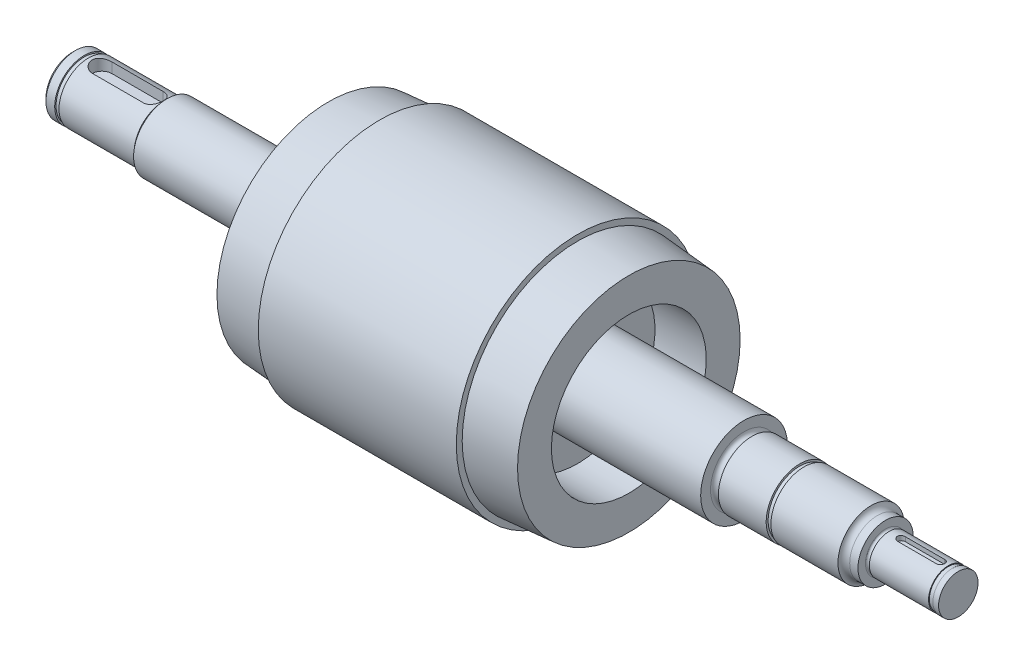
from build123d import *

# Parameters (mm, degrees)
ENL_V_MAT_EXTRU_1_DEPTH = 3
ENL_V_MAT_EXTRU_2_DEPTH = 1.2


with BuildPart() as part:
    # Esquisse1 → Révolution1 (revolve)
    with BuildSketch(Plane.XY, mode=Mode.PRIVATE) as r_volution1_sk:
        with BuildLine():
            Line((3, 7.5), (0.8, 7.5))
            Line((0.8, 7.5), (0, 6.7))
            Line((0, 6.7), (0, 0))
            Line((0, 0), (224.59, 0))
            Line((224.59, 0), (224.59, 5))
            Line((224.59, 5), (223.15, 5))
            Line((223.15, 5), (223.15, 4.8))
            Line((223.15, 4.8), (222.05, 4.8))
            Line((222.05, 4.8), (222.05, 5))
            Line((222.05, 5), (207.04, 5))
            ThreePointArc((207.04, 5), (206.552565835, 4.646846795), (206.15, 5.094339811))
            Line((206.15, 5.094339811), (206.15, 7))
            Line((206.15, 7), (204.056158882, 7))
            ThreePointArc((204.056158882, 7), (203.001644776, 7.396671283), (202.47, 8.39))
            Line((202.47, 8.39), (185.47, 8.39))
            Line((185.47, 8.39), (185.47, 8))
            Line((185.47, 8), (184.37, 8))
            Line((184.37, 8), (184.37, 8.5))
            Line((184.37, 8.5), (172.27, 8.5))
            ThreePointArc((172.27, 8.5), (171.27, 7.5), (170.27, 8.5))
            Line((170.27, 8.5), (170.27, 11))
            Line((170.27, 11), (128.06, 11))
            Line((128.06, 11), (128.06, 19.63))
            Line((128.06, 19.63), (141.06, 19.63))
            Line((141.06, 19.63), (141.06, 28.22))
            Line((141.06, 28.22), (128.06, 29.25))
            Line((128.06, 29.25), (128.06, 30.745))
            Line((128.06, 30.745), (77.86, 30.745))
            Line((77.86, 30.745), (77.86, 29.25))
            Line((77.86, 29.25), (64.86, 28.22))
            Line((64.86, 28.22), (64.86, 19.63))
            Line((64.86, 19.63), (77.86, 19.63))
            Line((77.86, 19.63), (77.86, 11))
            Line((77.86, 11), (55.48, 11))
            Line((55.48, 11), (55.48, 8.5))
            ThreePointArc((55.48, 8.5), (55.046987298, 8.25), (54.613974596, 8.5))
            Line((54.613974596, 8.5), (24, 8.5))
            Line((24, 8.5), (24, 7.499999996))
            ThreePointArc((24, 7.499999996), (23.566987298, 7.25), (23.133974599, 7.5))
            Line((23.133974599, 7.5), (4.1, 7.5))
            Line((4.1, 7.5), (4.1, 7.15))
            Line((4.1, 7.15), (3, 7.15))
            Line((3, 7.15), (3, 7.5))
        make_face()
    revolve(r_volution1_sk.sketch.rotate(Axis((-12.628248588, 0, 0), (1, 0, 0)), 90), axis=Axis((-12.628248588, 0, 0), (1, 0, 0)))

    # Esquisse2 → Enlèv. mat.-Extru.1 (cut)
    with BuildSketch(Plane(origin=(13.616987299, 7.5, 0), x_dir=(0, 0, -1), z_dir=(0, 1, 0))):
        with BuildLine():
            Line((2.5, 6.116987299), (2.5, -6.883012701))
            ThreePointArc((2.5, -6.883012701), (0, -9.383012701), (-2.5, -6.883012701))
            Line((-2.5, -6.883012701), (-2.5, 6.116987299))
            ThreePointArc((-2.5, 6.116987299), (0, 8.616987299), (2.5, 6.116987299))
        make_face()
    extrude(amount=-ENL_V_MAT_EXTRU_1_DEPTH, mode=Mode.SUBTRACT)

    # Esquisse3 → Enlèv. mat.-Extru.2 (cut)
    with BuildSketch(Plane(origin=(214.545, 5, 0), x_dir=(0, 0, -1), z_dir=(0, 1, 0))):
        with BuildLine():
            Line((1, 4.395), (1, -5.605))
            ThreePointArc((1, -5.605), (0, -6.605), (-1, -5.605))
            Line((-1, -5.605), (-1, 4.395))
            ThreePointArc((-1, 4.395), (0, 5.395), (1, 4.395))
        make_face()
    extrude(amount=-ENL_V_MAT_EXTRU_2_DEPTH, mode=Mode.SUBTRACT)


solid = part.part
